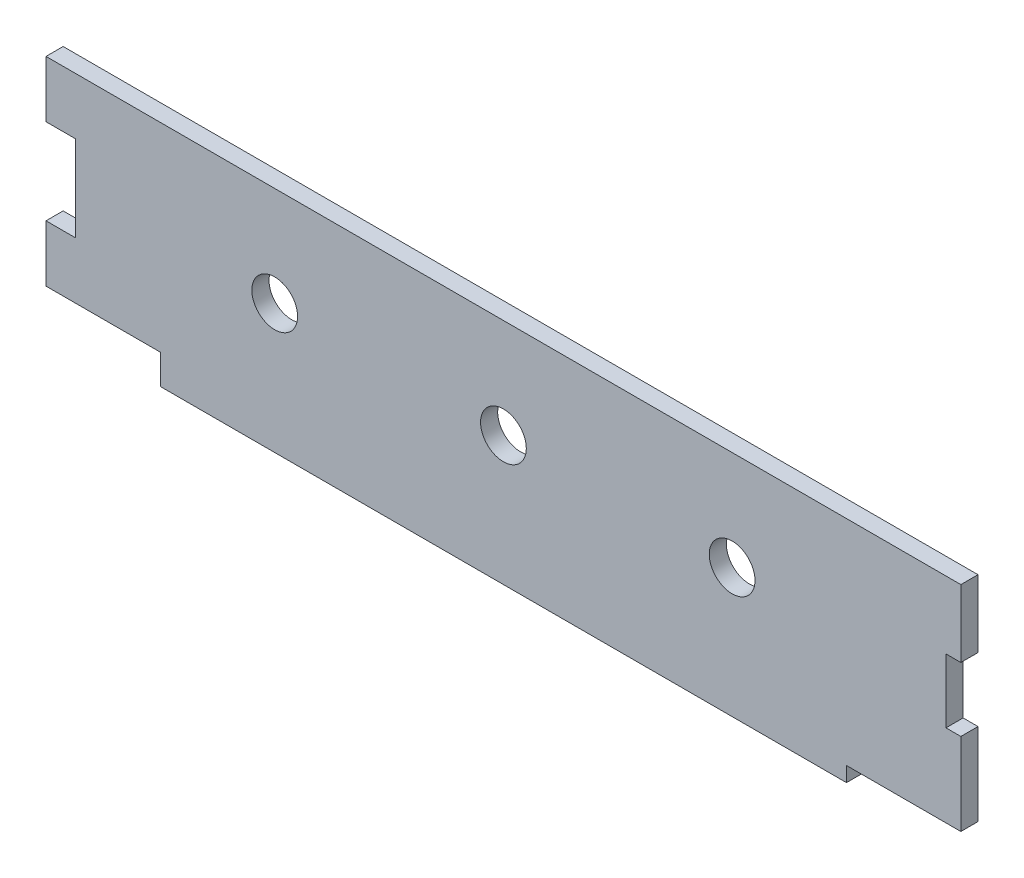
from build123d import *

# Parameters (mm, degrees)
CROQUIS1_R              = 2
SALIENTE_EXTRUIR1_DEPTH = 1.5


with BuildPart() as part:
    # Croquis1 → Saliente-Extruir1 (new body)
    with BuildSketch(Plane.XY):
        Polygon((-40, 8.7), (40, 8.7), (40, 2.8), (38.7, 2.8), (38.7, -2.8), (40, -2.8), (40, -10), (30, -10), (30, -11.3), (-30, -11.3), (-30, -8.7), (-40, -8.7), (-40, -3.75), (-37.4, -3.75), (-37.4, 3.75), (-40, 3.75), align=None)
        with Locations((20, 0)):
            Circle(CROQUIS1_R, mode=Mode.SUBTRACT)
        Circle(CROQUIS1_R, mode=Mode.SUBTRACT)
        with Locations((-20, 0)):
            Circle(CROQUIS1_R, mode=Mode.SUBTRACT)
    extrude(amount=SALIENTE_EXTRUIR1_DEPTH)


solid = part.part
